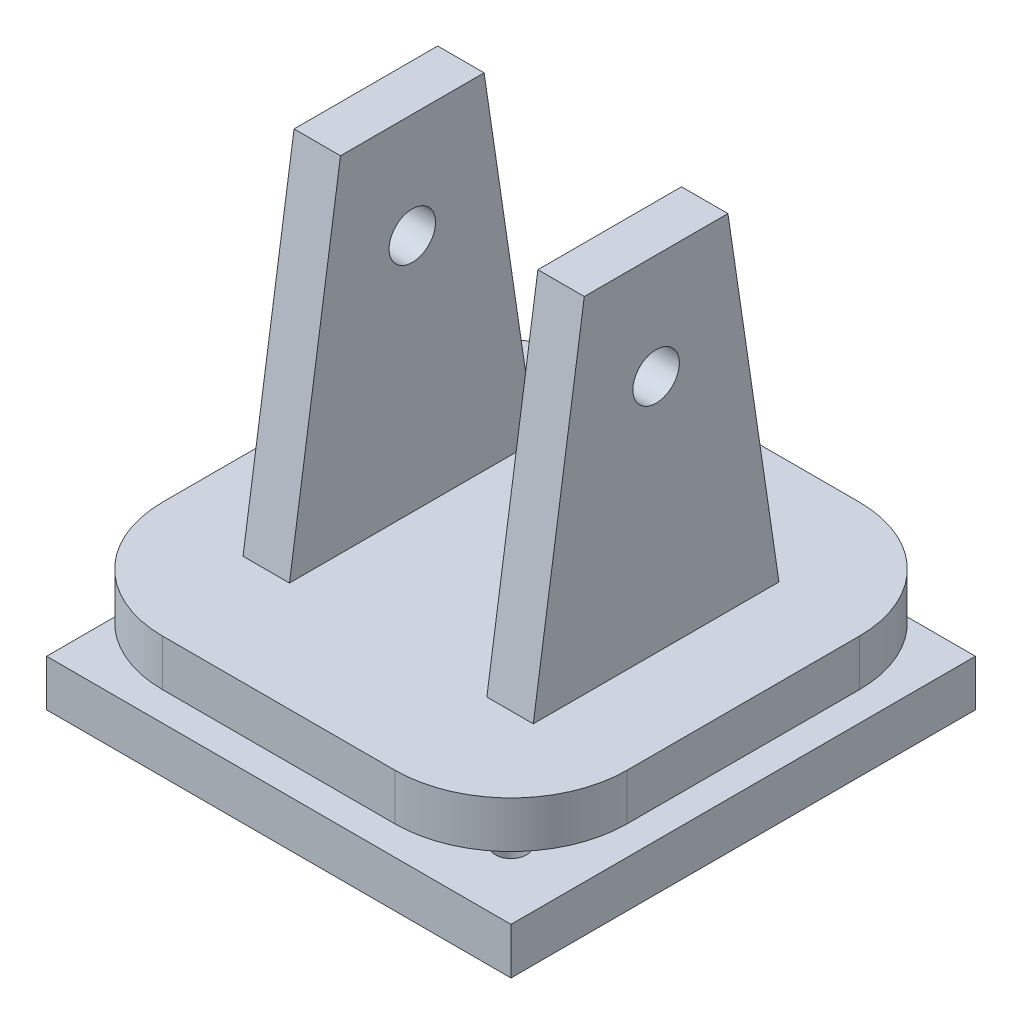
from build123d import *

# Parameters (mm, degrees)
SKETCH1_W           = 80
SKETCH1_H           = 80
BOSS_EXTRUDE1_DEPTH = 8
BOSS_EXTRUDE2_DEPTH = 8
SKETCH5_R           = 4
CUT_EXTRUDE2_DEPTH  = 85
SKETCH6_R           = 15
BOSS_EXTRUDE3_DEPTH = 5
SKETCH7_W           = 80
SKETCH7_H           = 80
SKETCH7_R           = 2.688208694
BOSS_EXTRUDE4_DEPTH = 8
FILLET1_R           = 20
FILLET2_R           = 20


with BuildPart() as part:
    # Sketch1 → Boss-Extrude1 (new body)
    with BuildSketch(Plane(origin=(0, 0, 0), x_dir=(1, 0, 0), z_dir=(0, 1, 0))):
        Rectangle(SKETCH1_W, SKETCH1_H)
    extrude(amount=BOSS_EXTRUDE1_DEPTH)

    # Sketch4 → Boss-Extrude2 (add)
    with BuildSketch(Plane(origin=(-25, 0, 0), x_dir=(0, 0, -1), z_dir=(1, 0, 0))):
        Polygon((-21.161091888, 8), (-12.370414248, 67.35253985), (12.370414248, 67.35253985), (21.161091888, 8), align=None)
    boss_extrude2 = extrude(amount=BOSS_EXTRUDE2_DEPTH)

    # Mirror1: Boss-Extrude2 across plane
    add(boss_extrude2.mirror(Plane(origin=(0, 0, 0), x_dir=(0, 0, 1), z_dir=(1, 0, 0))))

    # Sketch5 → Cut-Extrude2 (cut)
    with BuildSketch(Plane(origin=(25, 0, 0), x_dir=(0, 0, -1), z_dir=(1, 0, 0))):
        with Locations((0, 49.250906007)):
            Circle(SKETCH5_R)
    extrude(amount=-CUT_EXTRUDE2_DEPTH, mode=Mode.SUBTRACT)

    # Sketch6 → Boss-Extrude3 (add)
    with BuildSketch(Plane.XZ):
        with Locations(Location((0, 0, 0), (0, 0, 270))):
            Circle(SKETCH6_R)
    extrude(amount=BOSS_EXTRUDE3_DEPTH)

    # Sketch7 → Boss-Extrude4 (add)
    with BuildSketch(Plane.XZ.offset(5)):
        Rectangle(SKETCH7_W, SKETCH7_H)
        with Locations(Location((-28.284271247, 28.284271247, 0), (0, 0, 270))):
            Circle(SKETCH7_R, mode=Mode.SUBTRACT)
        with Locations(Location((28.284271247, 28.284271247, 0), (0, 0, 270))):
            Circle(SKETCH7_R, mode=Mode.SUBTRACT)
        with Locations(Location((28.284271247, -28.284271247, 0), (0, 0, 270))):
            Circle(SKETCH7_R, mode=Mode.SUBTRACT)
        with Locations(Location((-28.284271247, -28.284271247, 0), (0, 0, 270))):
            Circle(SKETCH7_R, mode=Mode.SUBTRACT)
    extrude(amount=BOSS_EXTRUDE4_DEPTH)

    # Fillet1
    fillet1_edges = [part.edges().sort_by_distance(p)[0] for p in [
        (-40, 4, -40),
    ]]
    fillet(fillet1_edges, radius=FILLET1_R)

    # Fillet2
    fillet2_edges = [part.edges().sort_by_distance(p)[0] for p in [
        (40, 4, 40),
        (-40, 4, 40),
        (40, 4, -40),
    ]]
    fillet(fillet2_edges, radius=FILLET2_R)


solid = part.part
